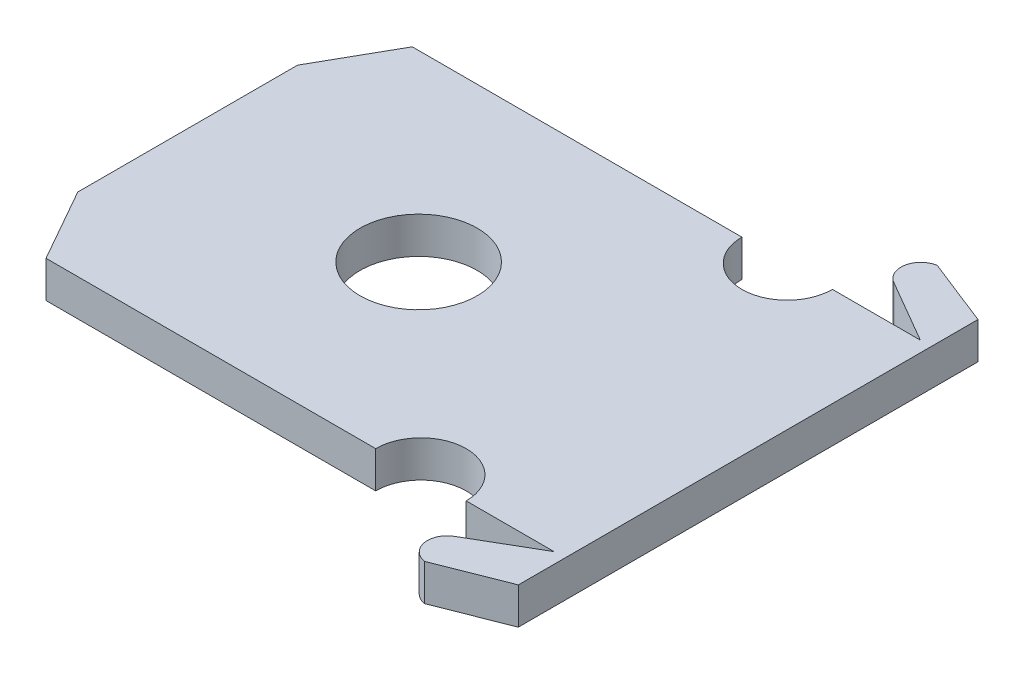
from build123d import *

# Parameters (mm, degrees)
SKETCH1_R           = 0.8
BOSS_EXTRUDE1_DEPTH = 0.5


with BuildPart() as part:
    # Sketch1 → Boss-Extrude1 (new body)
    with BuildSketch(Plane(origin=(0, 0, 0), x_dir=(1, 0, 0), z_dir=(0, 1, 0))):
        with BuildLine():
            Line((0, 1.5), (0, -1.5))
            Line((0, -1.5), (0.566386859, -2.5))
            Line((0.566386859, -2.5), (5.066386859, -2.5))
            ThreePointArc((5.066386859, -2.5), (5.684410747, -1.881976112), (6.302434635, -2.5))
            Line((6.302434635, -2.5), (7.502434635, -2.5))
            Line((7.502434635, -2.5), (6.640167687, -3.000108496))
            ThreePointArc((6.640167687, -3.000108496), (6.510535737, -3.282386176), (6.733125956, -3.499039646))
            Line((6.733125956, -3.499039646), (7.651443218, -3.137476564))
            Line((7.651443218, -3.137476564), (7.651443218, 3.137476564))
            Line((7.651443218, 3.137476564), (6.733125956, 3.499039646))
            ThreePointArc((6.733125956, 3.499039646), (6.510535737, 3.282386176), (6.640167687, 3.000108496))
            Line((6.640167687, 3.000108496), (7.502434635, 2.5))
            Line((7.502434635, 2.5), (6.302434635, 2.5))
            ThreePointArc((6.302434635, 2.5), (5.684410747, 1.881976112), (5.066386859, 2.5))
            Line((5.066386859, 2.5), (0.566386859, 2.5))
            Line((0.566386859, 2.5), (0, 1.5))
        make_face()
        with Locations(Location((3.153366843, 0, 0), (0, 0, 270))):
            Circle(SKETCH1_R, mode=Mode.SUBTRACT)
    extrude(amount=BOSS_EXTRUDE1_DEPTH)


solid = part.part
